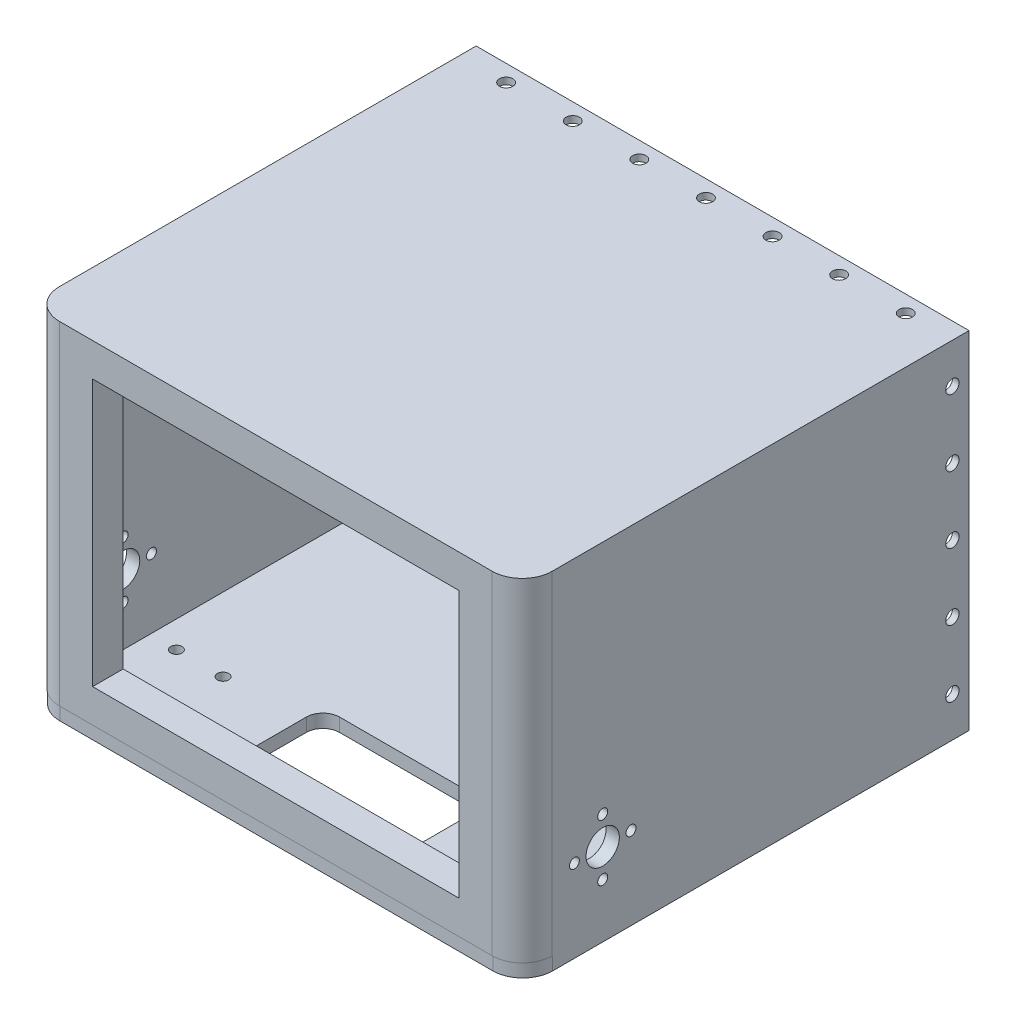
from build123d import *

# Parameters (mm, degrees)
SKETCH_1_R                = 1.7
EXTRUDE_6_DEPTH           = 4
EXTRUDE_7_DEPTH           = 100
SKETCH_10_W               = 140
SKETCH_10_H               = 96
CUT_EXTRUDE_20_DEPTH      = 115
CUT_EXTRUDE_22_DEPTH      = 220.402235989
CUT_EXTRUDE_22_DEPTH_BACK = 220.402235989
SKETCH_16_R               = 1.5
SKETCH_16_R_2             = 4
SKETCH_21_W               = 110
SKETCH_21_H               = 80
CUT_EXTRUDE_28_DEPTH      = 50
SKETCH_23_R               = 5
CUT_EXTRUDE_29_DEPTH      = 220.402235989
SKETCH_22_W               = 148
SKETCH_22_H               = 104
SKETCH_22_W_2             = 144
SKETCH_22_H_2             = 100
EXTRUDE_8_DEPTH           = 10
CUT_EXTRUDE_30_DEPTH      = 177.910545635
CUT_EXTRUDE_30_DEPTH_BACK = 177.910545635
SKETCH_27_R               = 2
CUT_EXTRUDE_31_DEPTH      = 219.058114174
CUT_EXTRUDE_31_DEPTH_BACK = 219.058114174
SKETCH_30_R               = 2


with BuildPart() as part:
    # 草图1 → 凸台-拉伸6 (new body)
    with BuildSketch(Plane(origin=(0, 0, 0), x_dir=(1, 0, 0), z_dir=(0, 1, 0))):
        with BuildLine():
            Line((-74, 0), (-74, -115))
            ThreePointArc((-74, -115), (-71.363961031, -121.363961031), (-65, -124))
            Line((-65, -124), (65, -124))
            ThreePointArc((65, -124), (71.363961031, -121.363961031), (74, -115))
            Line((74, -115), (74, 0))
            Line((74, 0), (-74, 0))
        make_face()
        with Locations(Location((-62, -108, 0), (0, 0, 270))):
            Circle(SKETCH_1_R, mode=Mode.SUBTRACT)
        with Locations(Location((-48, -108, 0), (0, 0, 270))):
            Circle(SKETCH_1_R, mode=Mode.SUBTRACT)
        with Locations(Location((48, -108, 0), (0, 0, 270))):
            Circle(SKETCH_1_R, mode=Mode.SUBTRACT)
        with Locations(Location((62, -108, 0), (0, 0, 270))):
            Circle(SKETCH_1_R, mode=Mode.SUBTRACT)
        with Locations(Location((-62, -92, 0), (0, 0, 270))):
            Circle(SKETCH_1_R, mode=Mode.SUBTRACT)
        with Locations(Location((-48, -92, 0), (0, 0, 270))):
            Circle(SKETCH_1_R, mode=Mode.SUBTRACT)
        with BuildLine():
            ThreePointArc((-25, -90), (-23.535533906, -86.464466094), (-20, -85))
            Line((-20, -85), (20, -85))
            ThreePointArc((20, -85), (23.535533906, -86.464466094), (25, -90))
            Line((25, -90), (25, -107.989151936))
            ThreePointArc((25, -107.989151936), (23.535533906, -111.524685842), (20, -112.989151936))
            Line((20, -112.989151936), (-20, -112.989151936))
            ThreePointArc((-20, -112.989151936), (-23.535533906, -111.524685842), (-25, -107.989151936))
            Line((-25, -107.989151936), (-25, -90))
        make_face(mode=Mode.SUBTRACT)
        with Locations(Location((48, -92, 0), (0, 0, 270))):
            Circle(SKETCH_1_R, mode=Mode.SUBTRACT)
        with Locations(Location((62, -92, 0), (0, 0, 270))):
            Circle(SKETCH_1_R, mode=Mode.SUBTRACT)
    extrude(amount=EXTRUDE_6_DEPTH)

    # 草图9 → 凸台-拉伸7 (add)
    with BuildSketch(Plane(origin=(0, 4, 0), x_dir=(1, 0, 0), z_dir=(0, 1, 0))):
        with BuildLine():
            Line((-74, 0), (74, 0))
            Line((74, 0), (74, -115.166586314))
            ThreePointArc((74, -115.166586314), (71.363961031, -121.530547345), (65, -124.166586314))
            Line((65, -124.166586314), (-65, -124.166586314))
            ThreePointArc((-65, -124.166586314), (-71.363961031, -121.530547345), (-74, -115.166586314))
            Line((-74, -115.166586314), (-74, 0))
        make_face()
    extrude(amount=EXTRUDE_7_DEPTH)

    # 草图10 → 切除-拉伸20 (cut)
    with BuildSketch(Plane(origin=(0, 0, 0), x_dir=(-1, 0, 0), z_dir=(0, 0, -1))):
        with Locations((0, 52)):
            Rectangle(SKETCH_10_W, SKETCH_10_H)
    extrude(amount=-CUT_EXTRUDE_20_DEPTH, mode=Mode.SUBTRACT)

    # 草图16 → 切除-拉伸22 (cut, two sides: drawn at the far end of the back side and taken through both)
    with BuildSketch(Plane.ZY.offset(74).offset(-CUT_EXTRUDE_22_DEPTH_BACK)):
        with Locations(Location((100, 16.25, 0), (0, 0, 180))):
            Circle(SKETCH_16_R)
        with Locations(Location((108.5, 24.75, 0), (0, 0, 180))):
            Circle(SKETCH_16_R)
        with Locations(Location((100, 24.75, 0), (0, 0, 180))):
            Circle(SKETCH_16_R_2)
        with Locations(Location((91.5, 24.75, 0), (0, 0, 180))):
            Circle(SKETCH_16_R)
        with Locations(Location((100, 33.25, 0), (0, 0, 180))):
            Circle(SKETCH_16_R)
    extrude(amount=CUT_EXTRUDE_22_DEPTH + CUT_EXTRUDE_22_DEPTH_BACK, mode=Mode.SUBTRACT)

    # 草图21 → 切除-拉伸28 (cut)
    with BuildSketch(Plane.XY.offset(124.166586314)):
        with Locations((0, 54)):
            Rectangle(SKETCH_21_W, SKETCH_21_H)
    extrude(amount=-CUT_EXTRUDE_28_DEPTH, mode=Mode.SUBTRACT)

    # 草图23 → 切除-拉伸29 (cut, through all)
    with BuildSketch(Plane.ZY.offset(74)):
        with Locations((100, 24.75)):
            Circle(SKETCH_23_R)
    extrude(amount=-CUT_EXTRUDE_29_DEPTH, mode=Mode.SUBTRACT)

    # 草图22 → 凸台-拉伸8 (add)
    with BuildSketch(Plane(origin=(0, 0, 0), x_dir=(-1, 0, 0), z_dir=(0, 0, -1))):
        with Locations((0, 52)):
            Rectangle(SKETCH_22_W, SKETCH_22_H)
        with Locations((0, 52)):
            Rectangle(SKETCH_22_W_2, SKETCH_22_H_2, mode=Mode.SUBTRACT)
    extrude(amount=EXTRUDE_8_DEPTH)

    # 草图27 → 切除-拉伸30 (cut, two sides: drawn at the far end of the back side and taken through both)
    with BuildSketch(Plane.XZ.offset(-102).offset(-CUT_EXTRUDE_30_DEPTH_BACK)):
        with Locations(Location((-60, -5, 0), (0, 0, 180))):
            Circle(SKETCH_27_R)
        with Locations(Location((-40, -5, 0), (0, 0, 180))):
            Circle(SKETCH_27_R)
        with Locations(Location((-20, -5, 0), (0, 0, 180))):
            Circle(SKETCH_27_R)
        with Locations(Location((40, -5, 0), (0, 0, 180))):
            Circle(SKETCH_27_R)
        with Locations(Location((0, -5, 0), (0, 0, 180))):
            Circle(SKETCH_27_R)
        with Locations(Location((20, -5, 0), (0, 0, 180))):
            Circle(SKETCH_27_R)
        with Locations(Location((60, -5, 0), (0, 0, 180))):
            Circle(SKETCH_27_R)
    extrude(amount=CUT_EXTRUDE_30_DEPTH + CUT_EXTRUDE_30_DEPTH_BACK, mode=Mode.SUBTRACT)

    # 草图30 → 切除-拉伸31 (cut, two sides: drawn at the far end of the back side and taken through both)
    with BuildSketch(Plane(origin=(-72, 0, 0), x_dir=(0, 0, -1), z_dir=(1, 0, 0)).offset(-CUT_EXTRUDE_31_DEPTH_BACK)):
        with Locations(Location((5, 52, 0), (0, 0, 90))):
            Circle(SKETCH_30_R)
        with Locations(Location((5, 72, 0), (0, 0, 90))):
            Circle(SKETCH_30_R)
        with Locations(Location((5, 92, 0), (0, 0, 90))):
            Circle(SKETCH_30_R)
        with Locations(Location((5, 12, 0), (0, 0, 90))):
            Circle(SKETCH_30_R)
        with Locations(Location((5, 32, 0), (0, 0, 90))):
            Circle(SKETCH_30_R)
    extrude(amount=CUT_EXTRUDE_31_DEPTH + CUT_EXTRUDE_31_DEPTH_BACK, mode=Mode.SUBTRACT)


solid = part.part
